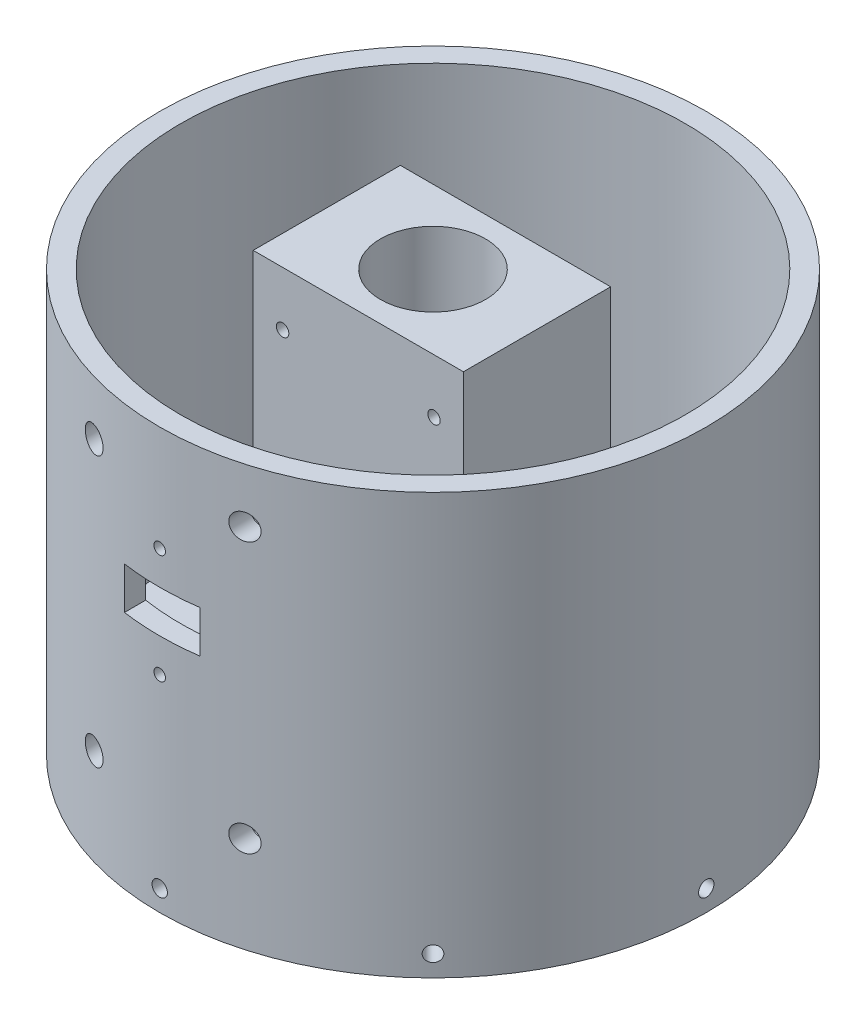
from build123d import *

# Parameters (mm, degrees)
SKETCH1_W           = 50
SKETCH1_H           = 35
SKETCH1_R           = 12.5
BOSS_EXTRUDE1_DEPTH = 100
SKETCH1_5_R         = 60
SKETCH1_5_W         = 50
SKETCH1_5_H         = 35
BOSS_EXTRUDE2_DEPTH = 10
SKETCH1_6_R         = 65
SKETCH1_6_R_2       = 60
BOSS_EXTRUDE3_DEPTH = 100
SKETCH11_R          = 2
SKETCH11_R_2        = 1.475
BOSS_EXTRUDE4_DEPTH = 2
CUT_EXTRUDE1_START  = -70
SKETCH3_W           = 18
SKETCH3_H           = 10
CUT_EXTRUDE1_DEPTH  = 30
CUT_EXTRUDE2_START  = -50
SKETCH11_6_R        = 1.475
CUT_EXTRUDE2_DEPTH  = 50
SKETCH40_R          = 1.825
CUT_EXTRUDE3_DEPTH  = 11
CIRPATTERN1_COUNT   = 8
CUT_EXTRUDE5_START  = -60
SKETCH42_R          = 3
CUT_EXTRUDE5_DEPTH  = 30
SKETCH43_W          = 6.209422006
SKETCH43_H          = 12.65
SKETCH43_W_2        = 12.65
SKETCH43_H_2        = 6.209422006
CUT_EXTRUDE6_DEPTH  = 10
CUT_EXTRUDE7_START  = 170
SKETCH44_R          = 1.375
CUT_EXTRUDE7_DEPTH  = 20


with BuildPart() as part:
    # Sketch1 → Boss-Extrude1 (new body)
    with BuildSketch(Plane(origin=(0, 0, 0), x_dir=(1, 0, 0), z_dir=(0, 1, 0))):
        with Locations((-0.260351773, 0)):
            Rectangle(SKETCH1_W, SKETCH1_H)
        with Locations(Location((0, 0, 0), (0, 0, 270))):
            Circle(SKETCH1_R, mode=Mode.SUBTRACT)
    extrude(amount=BOSS_EXTRUDE1_DEPTH)

    # Sketch1<5> → Boss-Extrude2 (add)
    with BuildSketch(Plane(origin=(0, 0, 0), x_dir=(1, 0, 0), z_dir=(0, 1, 0))):
        with Locations(Location((0, 0, 0), (0, 0, 270))):
            Circle(SKETCH1_5_R)
        with Locations((-0.260351773, 0)):
            Rectangle(SKETCH1_5_W, SKETCH1_5_H, mode=Mode.SUBTRACT)
    extrude(amount=BOSS_EXTRUDE2_DEPTH)

    # Sketch1<6> → Boss-Extrude3 (add)
    with BuildSketch(Plane(origin=(0, 0, 0), x_dir=(1, 0, 0), z_dir=(0, 1, 0))):
        with Locations(Location((0, 0, 0), (0, 0, 270))):
            Circle(SKETCH1_6_R)
        with Locations(Location((0, 0, 0), (0, 0, 270))):
            Circle(SKETCH1_6_R_2, mode=Mode.SUBTRACT)
    extrude(amount=BOSS_EXTRUDE3_DEPTH)

    # Sketch11 → Boss-Extrude4 (add)
    # profile 1 of 4: a face of its own
    with BuildSketch(Plane(origin=(0, 0, -17.5), x_dir=(-1, 0, 0), z_dir=(0, 0, -1))):
        with Locations(Location((-17.739648227, 87.125, 0), (0, 0, 180))):
            Circle(SKETCH11_R)
        with Locations((-17.739648227, 87.125)):
            Circle(SKETCH11_R_2, mode=Mode.SUBTRACT)
    # profile 2 of 4: a face of its own
    with BuildSketch(Plane(origin=(0, 0, -17.5), x_dir=(-1, 0, 0), z_dir=(0, 0, -1))):
        with Locations(Location((18.260351773, 87.125, 0), (0, 0, 180))):
            Circle(SKETCH11_R)
        with Locations((18.260351773, 87.125)):
            Circle(SKETCH11_R_2, mode=Mode.SUBTRACT)
    # profile 3 of 4: a face of its own
    with BuildSketch(Plane(origin=(0, 0, -17.5), x_dir=(-1, 0, 0), z_dir=(0, 0, -1))):
        with Locations(Location((18.260351773, 22.875, 0), (0, 0, 180))):
            Circle(SKETCH11_R)
        with Locations((18.260351773, 22.875)):
            Circle(SKETCH11_R_2, mode=Mode.SUBTRACT)
    # profile 4 of 4: a face of its own
    with BuildSketch(Plane(origin=(0, 0, -17.5), x_dir=(-1, 0, 0), z_dir=(0, 0, -1))):
        with Locations(Location((-17.739648227, 22.875, 0), (0, 0, 180))):
            Circle(SKETCH11_R)
        with Locations((-17.739648227, 22.875)):
            Circle(SKETCH11_R_2, mode=Mode.SUBTRACT)
    extrude(amount=BOSS_EXTRUDE4_DEPTH)

    # Sketch3 → Cut-Extrude1 (cut)
    with BuildSketch(Plane(origin=(0, 0, -17.5), x_dir=(-1, 0, 0), z_dir=(0, 0, -1)).offset(CUT_EXTRUDE1_START)):
        with Locations((0, 62)):
            Rectangle(SKETCH3_W, SKETCH3_H)
    extrude(amount=-CUT_EXTRUDE1_DEPTH, mode=Mode.SUBTRACT)

    # Sketch11<6> → Cut-Extrude2 (cut)
    with BuildSketch(Plane(origin=(0, 0, -17.5), x_dir=(-1, 0, 0), z_dir=(0, 0, -1)).offset(CUT_EXTRUDE2_START)):
        with Locations(Location((18.260351773, 87.125, 0), (0, 0, 180))):
            Circle(SKETCH11_6_R)
        with Locations(Location((-17.739648227, 22.875, 0), (0, 0, 180))):
            Circle(SKETCH11_6_R)
        with Locations(Location((-17.739648227, 87.125, 0), (0, 0, 180))):
            Circle(SKETCH11_6_R)
        with Locations(Location((18.260351773, 22.875, 0), (0, 0, 180))):
            Circle(SKETCH11_6_R)
    extrude(amount=CUT_EXTRUDE2_DEPTH, mode=Mode.SUBTRACT)

    # Sketch40 → Cut-Extrude3 (cut)
    with BuildSketch(Plane.XY.offset(65)):
        with Locations((0, 5)):
            Circle(SKETCH40_R)
    cut_extrude3 = extrude(amount=-CUT_EXTRUDE3_DEPTH, mode=Mode.SUBTRACT)

    # CirPattern1: Cut-Extrude3 ×8 about axis
    cirpattern1_axis = Axis((0, 0, 0), (0, 1, 0))
    for i in range(1, CIRPATTERN1_COUNT):
        add(cut_extrude3.rotate(cirpattern1_axis, i * 360 / CIRPATTERN1_COUNT), mode=Mode.SUBTRACT)

    # Sketch42 → Cut-Extrude5 (cut)
    with BuildSketch(Plane(origin=(0, 0, -19.5), x_dir=(-1, 0, 0), z_dir=(0, 0, -1)).offset(CUT_EXTRUDE5_START)):
        with Locations((-17.739648227, 87.11)):
            Circle(SKETCH42_R)
        with Locations((18.260351773, 87.11)):
            Circle(SKETCH42_R)
        with Locations((18.260351773, 22.89)):
            Circle(SKETCH42_R)
        with Locations((-17.739648227, 22.89)):
            Circle(SKETCH42_R)
    extrude(amount=-CUT_EXTRUDE5_DEPTH, mode=Mode.SUBTRACT)

    # Sketch43 → Cut-Extrude6 (cut)
    with BuildSketch(Plane.XZ):
        with Locations((-30.969711003, 44.53)):
            Rectangle(SKETCH43_W, SKETCH43_H)
        with Locations((44.53, 30.969711003)):
            Rectangle(SKETCH43_W_2, SKETCH43_H_2)
        with Locations((30.969711003, -44.53)):
            Rectangle(SKETCH43_W, SKETCH43_H)
        with Locations((-44.53, -30.969711003)):
            Rectangle(SKETCH43_W_2, SKETCH43_H_2)
    extrude(amount=-CUT_EXTRUDE6_DEPTH, mode=Mode.SUBTRACT)

    # Sketch44 → Cut-Extrude7 (cut)
    with BuildSketch(Plane(origin=(-56.9703445, -4.691827803, -98.659679101), x_dir=(1, 0, 0), z_dir=(0, 0, 1)).offset(CUT_EXTRUDE7_START)):
        with Locations((56.9703445, 79.691827803)):
            Circle(SKETCH44_R)
        with Locations((56.9703445, 53.691827803)):
            Circle(SKETCH44_R)
    extrude(amount=-CUT_EXTRUDE7_DEPTH, mode=Mode.SUBTRACT)


solid = part.part
